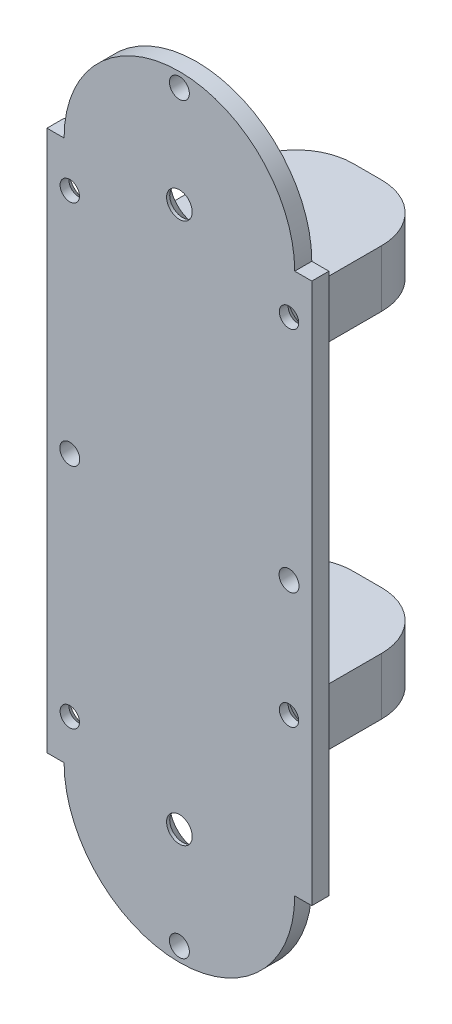
from build123d import *

# Parameters (mm, degrees)
ESTRUSIONE_ESTRUSIONE1_DEPTH          = 3
FORO_SVASATO_PER_VITE_M4_1_AT_2_COUNT = 2
FORO_SVASATO_PER_VITE_M4_1_AT_2_PITCH = 95
FORO_SVASATO_PER_VITE_M3_1_AT_2_COUNT = 2
FORO_SVASATO_PER_VITE_M3_1_AT_2_PITCH = 60.5
FORO_SVASATO_PER_VITE_M3_1_AT_3_COUNT = 2
FORO_SVASATO_PER_VITE_M3_1_AT_3_PITCH = 88.782036471
FORO_SVASATO_PER_VITE_M3_1_AT_4_COUNT = 2
FORO_SVASATO_PER_VITE_M3_1_AT_4_PITCH = 38.5
TAGLIO_ESTRUSIONE2_REACH              = 73.691
SCHIZZO9_R                            = 1.75
SKETCH4_W                             = 25
SKETCH4_H                             = 10
BOSS_EXTRUDE3_DEPTH                   = 30
SKETCH6_R                             = 3
CUT_EXTRUDE2_DEPTH                    = 111.474544579
CHAMFER1_SIZE                         = 2
FILLET1_R                             = 10


with BuildPart() as part:
    # Schizzo1 → Estrusione-Estrusione1 (new body)
    with BuildSketch(Plane.XY):
        with BuildLine():
            Line((20.25, -47.5), (23.25, -47.5))
            Line((23.25, -47.5), (23.25, 47.5))
            Line((23.25, 47.5), (20.25, 47.5))
            ThreePointArc((20.25, 47.5), (0, 67.75), (-20.25, 47.5))
            Line((-20.25, 47.5), (-23.25, 47.5))
            Line((-23.25, 47.5), (-23.25, -47.5))
            Line((-23.25, -47.5), (-20.25, -47.5))
            ThreePointArc((-20.25, -47.5), (0, -67.75), (20.25, -47.5))
        make_face()
    extrude(amount=ESTRUSIONE_ESTRUSIONE1_DEPTH)

    # Schizzo5 → Foro svasato per Vite M4-1 (revolve, cut)
    with BuildSketch(Plane(origin=(0, 47.5, 0), x_dir=(0, 1, 0), z_dir=(1, 0, 0))):
        Polygon((0, 0), (0, 3), (2.25, 3), (2.25, 2.45), (4.7, 0), align=None)
    foro_svasato_per_vite_m4_1 = revolve(axis=Axis((0, 47.5, -6.35), (0, 0, 1)), mode=Mode.SUBTRACT)

    # Foro svasato per Vite M4-1 at 2: Foro svasato per Vite M4-1 ×2
    with Locations(*[(0, -i * FORO_SVASATO_PER_VITE_M4_1_AT_2_PITCH, 0) for i in range(1, FORO_SVASATO_PER_VITE_M4_1_AT_2_COUNT)]):
        add(foro_svasato_per_vite_m4_1, mode=Mode.SUBTRACT)

    # Schizzo8 → Foro svasato per Vite M3-1 (revolve, cut)
    with BuildSketch(Plane(origin=(19.25, 40, 0), x_dir=(0, 1, 0), z_dir=(1, 0, 0))):
        Polygon((0, 0), (0, 3), (1.7, 3), (1.7, 1.45), (3.15, 0), align=None)
    foro_svasato_per_vite_m3_1 = revolve(axis=Axis((19.25, 40, -6.35), (0, 0, 1)), mode=Mode.SUBTRACT)

    # Foro svasato per Vite M3-1 at 2: Foro svasato per Vite M3-1 ×2
    with Locations(*[(0, -i * FORO_SVASATO_PER_VITE_M3_1_AT_2_PITCH, 0) for i in range(1, FORO_SVASATO_PER_VITE_M3_1_AT_2_COUNT)]):
        add(foro_svasato_per_vite_m3_1, mode=Mode.SUBTRACT)

    # Foro svasato per Vite M3-1 at 3: Foro svasato per Vite M3-1 ×2
    with Locations(*[Vector(-0.43364628172754605, -0.9010831828104849, 0) * (i * FORO_SVASATO_PER_VITE_M3_1_AT_3_PITCH) for i in range(1, FORO_SVASATO_PER_VITE_M3_1_AT_3_COUNT)]):
        add(foro_svasato_per_vite_m3_1, mode=Mode.SUBTRACT)

    # Foro svasato per Vite M3-1 at 4: Foro svasato per Vite M3-1 ×2
    with Locations(*[(-i * FORO_SVASATO_PER_VITE_M3_1_AT_4_PITCH, 0, 0) for i in range(1, FORO_SVASATO_PER_VITE_M3_1_AT_4_COUNT)]):
        add(foro_svasato_per_vite_m3_1, mode=Mode.SUBTRACT)

    # Schizzo9 → Taglio-Estrusione2 (cut, up to next)
    with BuildSketch(Plane(origin=(0, 0, 0), x_dir=(-1, 0, 0), z_dir=(0, 0, -1)), mode=Mode.PRIVATE) as taglio_estrusione2_sk1:
        with Locations((-19.25, 0)):
            Circle(SCHIZZO9_R)
    taglio_estrusione2_tool1 = extrude(taglio_estrusione2_sk1.sketch, amount=-TAGLIO_ESTRUSIONE2_REACH, mode=Mode.PRIVATE) & part.part
    # Schizzo9 → Taglio-Estrusione2 (cut, up to next)
    with BuildSketch(Plane(origin=(0, 0, 0), x_dir=(-1, 0, 0), z_dir=(0, 0, -1)), mode=Mode.PRIVATE) as taglio_estrusione2_sk2:
        with Locations((19.25, 0)):
            Circle(SCHIZZO9_R)
    taglio_estrusione2_tool2 = extrude(taglio_estrusione2_sk2.sketch, amount=-TAGLIO_ESTRUSIONE2_REACH, mode=Mode.PRIVATE) & part.part
    # Schizzo9 → Taglio-Estrusione2 (cut, up to next)
    with BuildSketch(Plane(origin=(0, 0, 0), x_dir=(-1, 0, 0), z_dir=(0, 0, -1)), mode=Mode.PRIVATE) as taglio_estrusione2_sk3:
        with Locations((0, 65.25)):
            Circle(SCHIZZO9_R)
    taglio_estrusione2_tool3 = extrude(taglio_estrusione2_sk3.sketch, amount=-TAGLIO_ESTRUSIONE2_REACH, mode=Mode.PRIVATE) & part.part
    # Schizzo9 → Taglio-Estrusione2 (cut, up to next)
    with BuildSketch(Plane(origin=(0, 0, 0), x_dir=(-1, 0, 0), z_dir=(0, 0, -1)), mode=Mode.PRIVATE) as taglio_estrusione2_sk4:
        with Locations((0, -65.25)):
            Circle(SCHIZZO9_R)
    taglio_estrusione2_tool4 = extrude(taglio_estrusione2_sk4.sketch, amount=-TAGLIO_ESTRUSIONE2_REACH, mode=Mode.PRIVATE) & part.part
    add(taglio_estrusione2_tool1.solids().sort_by_distance((19.25, 0, 0))[0], mode=Mode.SUBTRACT)
    add(taglio_estrusione2_tool2.solids().sort_by_distance((-19.25, 0, 0))[0], mode=Mode.SUBTRACT)
    add(taglio_estrusione2_tool3.solids().sort_by_distance((0, 65.25, 0))[0], mode=Mode.SUBTRACT)
    add(taglio_estrusione2_tool4.solids().sort_by_distance((0, -65.25, 0))[0], mode=Mode.SUBTRACT)

    # Sketch4 → Boss-Extrude3 (add)
    with BuildSketch(Plane(origin=(0, 0, 0), x_dir=(-1, 0, 0), z_dir=(0, 0, -1))):
        with Locations((0, 31)):
            Rectangle(SKETCH4_W, SKETCH4_H)
        with Locations((0, -31)):
            Rectangle(SKETCH4_W, SKETCH4_H)
    extrude(amount=BOSS_EXTRUDE3_DEPTH)

    # Sketch6 → Cut-Extrude2 (cut, through all)
    with BuildSketch(Plane(origin=(0, 36, 0), x_dir=(1, 0, 0), z_dir=(0, 1, 0))):
        with Locations(Location((0, 15, 0), (0, 0, 180))):
            Circle(SKETCH6_R)
    extrude(amount=-CUT_EXTRUDE2_DEPTH, mode=Mode.SUBTRACT)

    # Chamfer1
    chamfer1_edges = [part.edges().sort_by_distance(p)[0] for p in [
        (-12.5, 31, 0),
        (0, 36, 0),
        (12.5, 31, 0),
        (0, 26, 0),
        (0, -26, 0),
        (12.5, -31, 0),
        (0, -36, 0),
        (-12.5, -31, 0),
    ]]
    chamfer(chamfer1_edges, length=CHAMFER1_SIZE)

    # Fillet1
    fillet1_edges = [part.edges().sort_by_distance(p)[0] for p in [
        (-12.5, -31, -30),
        (-12.5, 31, -30),
        (12.5, 31, -30),
        (12.5, -31, -30),
    ]]
    fillet(fillet1_edges, radius=FILLET1_R)


solid = part.part
